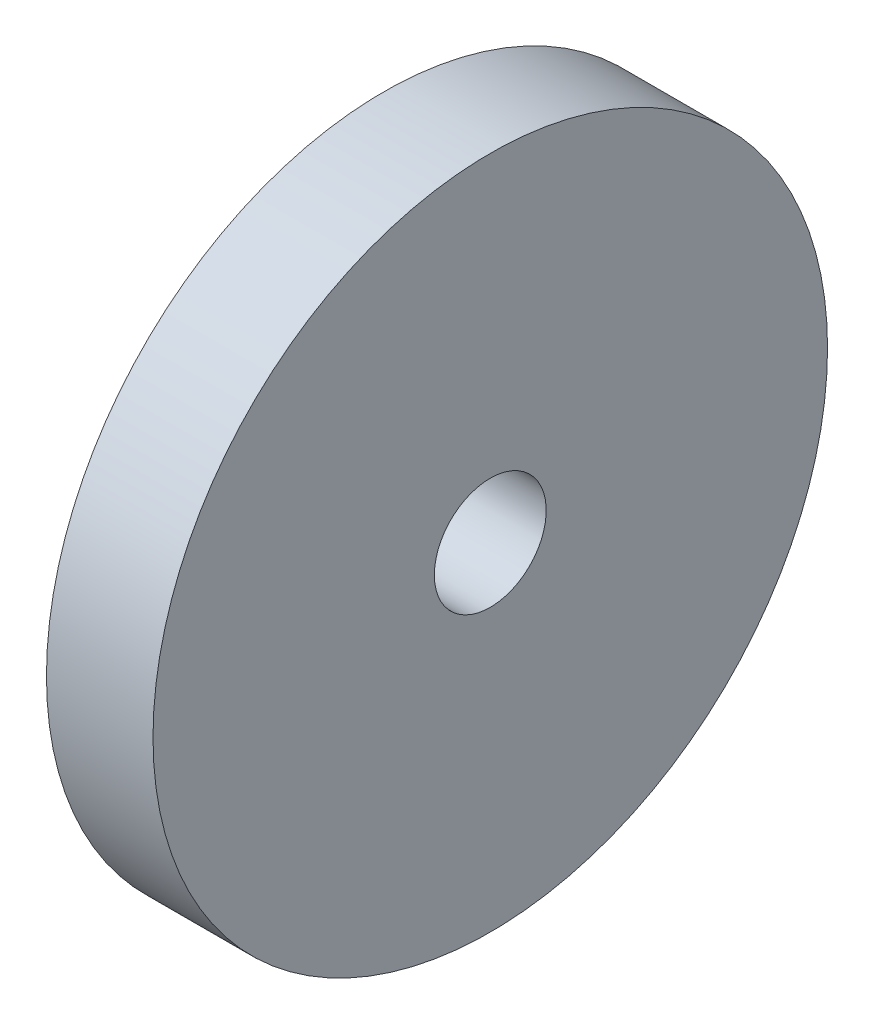
from build123d import *

# Parameters (mm, degrees)
SKETCH2_W = 9.628787261
SKETCH2_H = 25.426


with BuildPart() as part:
    # Sketch2 → Revolve1 (revolve)
    with BuildSketch(Plane.XZ.offset(-32.815)):
        with Locations((-309.926547775, -157.467)):
            Rectangle(SKETCH2_W, SKETCH2_H)
    revolve(axis=Axis((-332.206594657, 32.815, -139.7), (1, 0, 0)))


solid = part.part
